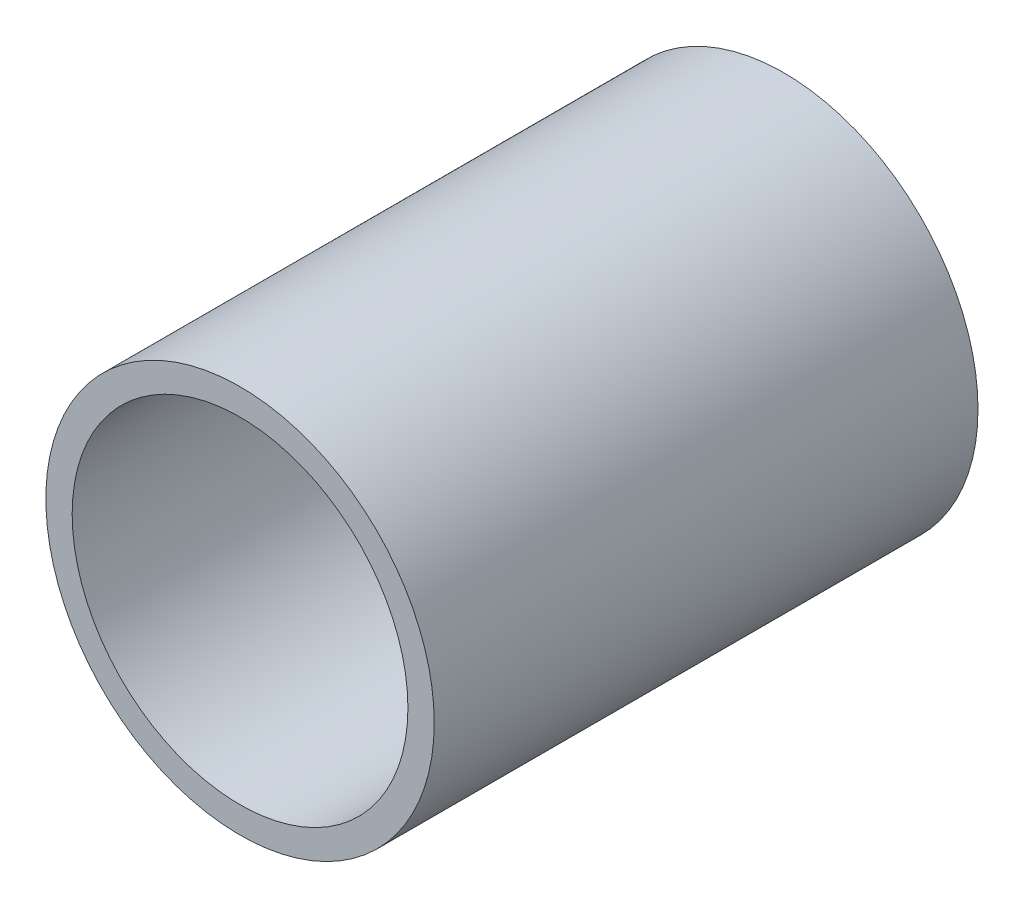
from build123d import *

# Parameters (mm, degrees)
SKETCH1_R           = 25
BOSS_EXTRUDE1_DEPTH = 70
SKETCH2_R           = 21.611817806
CUT_EXTRUDE1_DEPTH  = 60


with BuildPart() as part:
    # Sketch1 → Boss-Extrude1 (new body)
    with BuildSketch(Plane.XY):
        Circle(SKETCH1_R)
    extrude(amount=BOSS_EXTRUDE1_DEPTH)

    # Sketch2 → Cut-Extrude1 (cut)
    with BuildSketch(Plane.XY.offset(70)):
        Circle(SKETCH2_R)
    extrude(amount=-CUT_EXTRUDE1_DEPTH, mode=Mode.SUBTRACT)


solid = part.part
